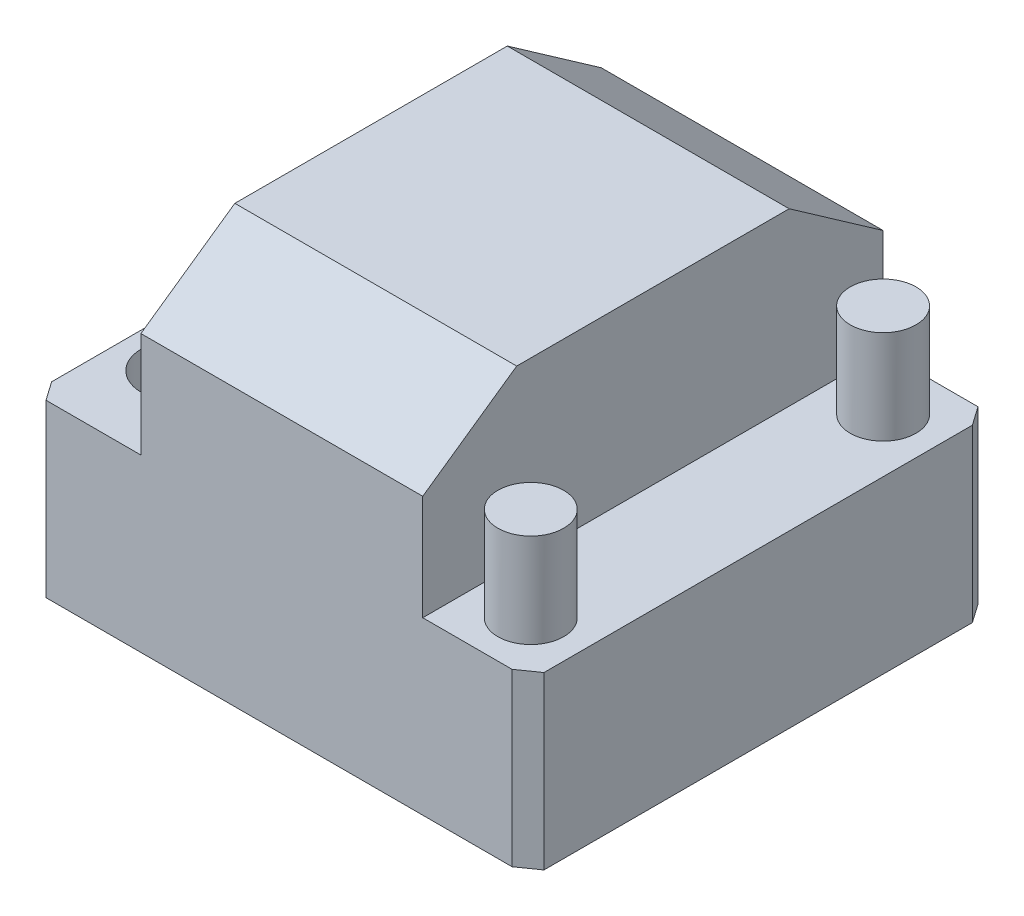
from build123d import *
from OCP.BRepFilletAPI import BRepFilletAPI_MakeChamfer

# Parameters (mm, degrees)
SKETCH2_W           = 53
SKETCH2_H           = 49
BOSS_EXTRUDE1_DEPTH = 36.4
SKETCH3_W           = 11.5
SKETCH3_H           = 18.2
CUT_EXTRUDE1_DEPTH  = 81.839099451
CHAMFER1_SIZE       = 10
CHAMFER1_SIZE2      = 7.002075382
CHAMFER2_SIZE       = 2
CHAMFER2_SIZE2      = 1.400415076
SKETCH4_R           = 3.5
BOSS_EXTRUDE2_DEPTH = 10
SKETCH5_R           = 4
CUT_EXTRUDE2_DEPTH  = 10


with BuildPart() as part:
    # Sketch2 → Boss-Extrude1 (new body)
    with BuildSketch(Plane(origin=(0, 0, 0), x_dir=(1, 0, 0), z_dir=(0, 1, 0))):
        with Locations((26.5, -24.5)):
            Rectangle(SKETCH2_W, SKETCH2_H)
    extrude(amount=BOSS_EXTRUDE1_DEPTH)

    # Sketch3 → Cut-Extrude1 (cut, through all)
    with BuildSketch(Plane.XY.offset(49)):
        with Locations((5.75, 27.3)):
            Rectangle(SKETCH3_W, SKETCH3_H)
        with Locations((47.25, 27.3)):
            Rectangle(SKETCH3_W, SKETCH3_H)
    extrude(amount=-CUT_EXTRUDE1_DEPTH, mode=Mode.SUBTRACT)

    # Chamfer1
    chamfer1_edges = [part.edges().sort_by_distance(p)[0] for p in [
        (26.5, 36.4, 49),
        (26.5, 36.4, 0),
    ]]
    chamfer1_side = [part.faces().sort_by_distance(p)[0] for p in [
        (26.5, 36.4, 24.5),
    ]]
    chamfer(chamfer1_edges, length=CHAMFER1_SIZE, length2=CHAMFER1_SIZE2, reference=chamfer1_side[0])

    # Chamfer2: one chamfer whose edges measure the first distance from different faces: ONE call of the kernel's chamfer builder (chamfer() names one face for all edges)
    chamfer2_edges_1 = [part.edges().sort_by_distance(p)[0] for p in [
        (0, 9.1, 0),
    ]]
    chamfer2_side_1 = [part.faces().sort_by_distance(p)[0] for p in [
        (26.5, 12.896841884, 0),
    ]]
    chamfer2_edges_2 = [part.edges().sort_by_distance(p)[0] for p in [
        (53, 9.1, 0),
    ]]
    chamfer2_side_2 = [part.faces().sort_by_distance(p)[0] for p in [
        (53, 9.1, 24.5),
    ]]
    chamfer2_edges_3 = [part.edges().sort_by_distance(p)[0] for p in [
        (53, 9.1, 49),
    ]]
    chamfer2_side_3 = [part.faces().sort_by_distance(p)[0] for p in [
        (26.5, 12.896841884, 49),
    ]]
    chamfer2_edges_4 = [part.edges().sort_by_distance(p)[0] for p in [
        (0, 9.1, 49),
    ]]
    chamfer2_side_4 = [part.faces().sort_by_distance(p)[0] for p in [
        (0, 9.1, 24.5),
    ]]
    chamfer2 = BRepFilletAPI_MakeChamfer(part.part.solid().wrapped)
    for e in chamfer2_edges_1:
        chamfer2.Add(CHAMFER2_SIZE, CHAMFER2_SIZE2, e.wrapped, chamfer2_side_1[0].wrapped)  # the first distance lies on this face
    for e in chamfer2_edges_2:
        chamfer2.Add(CHAMFER2_SIZE, CHAMFER2_SIZE2, e.wrapped, chamfer2_side_2[0].wrapped)  # the first distance lies on this face
    for e in chamfer2_edges_3:
        chamfer2.Add(CHAMFER2_SIZE, CHAMFER2_SIZE2, e.wrapped, chamfer2_side_3[0].wrapped)  # the first distance lies on this face
    for e in chamfer2_edges_4:
        chamfer2.Add(CHAMFER2_SIZE, CHAMFER2_SIZE2, e.wrapped, chamfer2_side_4[0].wrapped)  # the first distance lies on this face
    add(Compound.cast(chamfer2.Shape()), mode=Mode.REPLACE)

    # Sketch4 → Boss-Extrude2 (add)
    with BuildSketch(Plane(origin=(0, 18.2, 0), x_dir=(1, 0, 0), z_dir=(0, 1, 0))):
        with Locations(Location((47.25, -43.25, 0), (0, 0, 90))):
            Circle(SKETCH4_R)
        with Locations(Location((47.25, -5.75, 0), (0, 0, 90))):
            Circle(SKETCH4_R)
    extrude(amount=BOSS_EXTRUDE2_DEPTH)

    # Sketch5 → Cut-Extrude2 (cut)
    with BuildSketch(Plane(origin=(0, 18.2, 0), x_dir=(1, 0, 0), z_dir=(0, 1, 0))):
        with Locations(Location((5.75, -9.200207538, 0), (0, 0, 270))):
            Circle(SKETCH5_R)
        with Locations(Location((5.75, -39.200207538, 0), (0, 0, 270))):
            Circle(SKETCH5_R)
        with Locations(Location((5.75, -24.200207538, 0), (0, 0, 270))):
            Circle(SKETCH5_R)
    extrude(amount=-CUT_EXTRUDE2_DEPTH, mode=Mode.SUBTRACT)


solid = part.part
